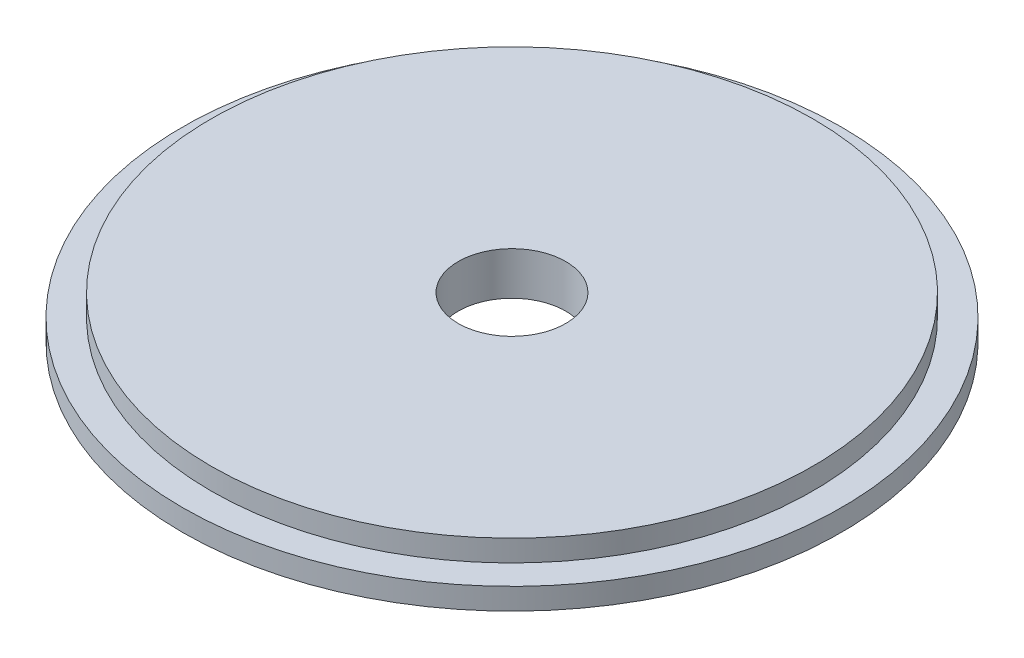
from build123d import *

# Parameters (mm, degrees)
SKETCH1_R           = 23
BOSS_EXTRUDE1_DEPTH = 1.5
SKETCH2_R           = 21
BOSS_EXTRUDE2_DEPTH = 1.5
SKETCH3_R           = 3.75
CUT_EXTRUDE2_DEPTH  = 33.664965942


with BuildPart() as part:
    # Sketch1 → Boss-Extrude1 (new body)
    with BuildSketch(Plane(origin=(0, 0, 0), x_dir=(1, 0, 0), z_dir=(0, 1, 0))):
        with Locations(Location((0, 0, 0), (0, 0, 270))):
            Circle(SKETCH1_R)
    extrude(amount=BOSS_EXTRUDE1_DEPTH)

    # Sketch2 → Boss-Extrude2 (add)
    with BuildSketch(Plane(origin=(0, 1.5, 0), x_dir=(1, 0, 0), z_dir=(0, 1, 0))):
        with Locations(Location((0, 0, 0), (0, 0, 270))):
            Circle(SKETCH2_R)
    extrude(amount=BOSS_EXTRUDE2_DEPTH)

    # Sketch3 → Cut-Extrude2 (cut, through all)
    with BuildSketch(Plane(origin=(0, 3, 0), x_dir=(1, 0, 0), z_dir=(0, 1, 0))):
        with Locations(Location((0, 0, 0), (0, 0, 270))):
            Circle(SKETCH3_R)
    extrude(amount=-CUT_EXTRUDE2_DEPTH, mode=Mode.SUBTRACT)


solid = part.part
